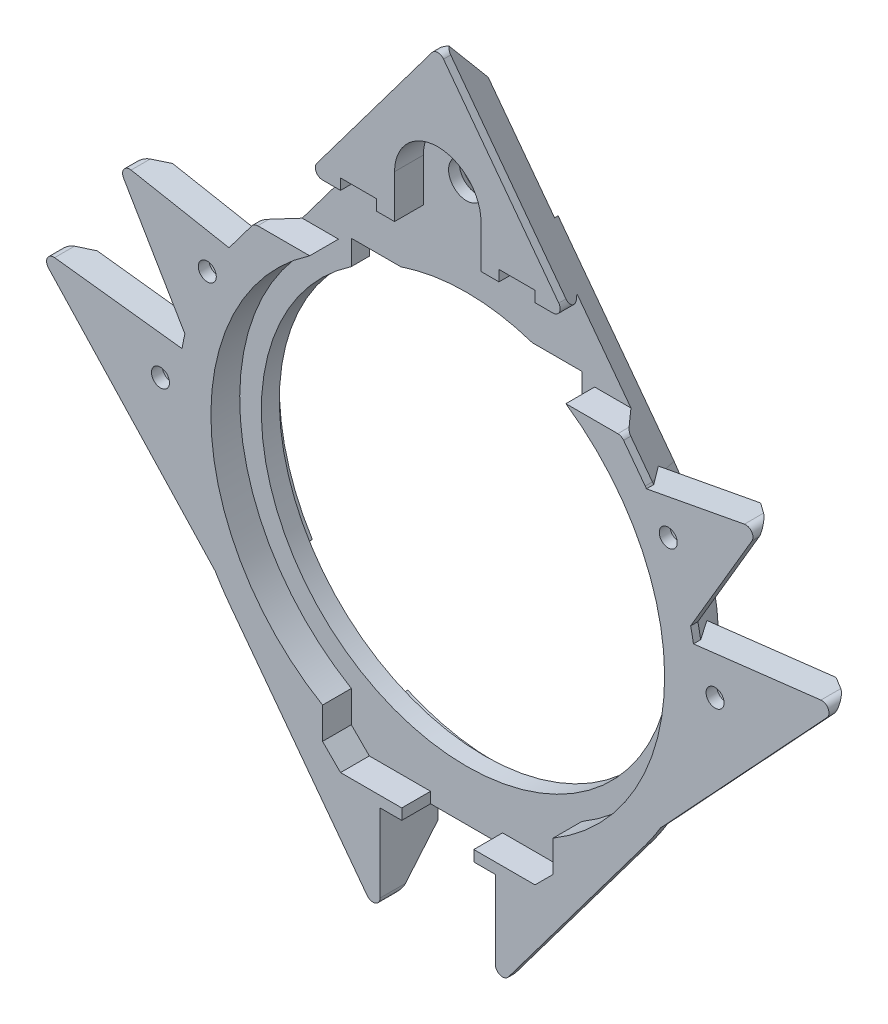
from build123d import *
from OCP.BRepFilletAPI import BRepFilletAPI_MakeChamfer

# Parameters (mm, degrees)
SKETCH_1_R                = 28.5
EXTRUDE_1_DEPTH           = 8
CHAMFER_12_SIZE           = 7
CHAMFER_12_SIZE2          = 5
SKETCH_11_R               = 30
CUT_EXTRUDE_1_DEPTH       = 1.5
EXTRUDE_5_DEPTH           = 4
EXTRUDE_5_2_DEPTH         = 4
EXTRUDE_5_3_DEPTH         = 4
EXTRUDE_5_4_DEPTH         = 4
CHAMFER_13_SIZE           = 3
CHAMFER_14_SIZE           = 3
CHAMFER_15_SIZE           = 3
CHAMFER_16_SIZE           = 3
CUT_EXTRUDE_7_DEPTH       = 4
SKETCH_13_W               = 16
SKETCH_13_H               = 26
CUT_EXTRUDE_2_DEPTH       = 4
CUT_EXTRUDE_8_DEPTH       = 4
CUT_EXTRUDE_9_DEPTH       = 83.10418193
CUT_EXTRUDE_9_DEPTH_BACK  = 2.5
SKETCH_25_R               = 3
HOLE_WIZARD_2_5_2_5_1_D   = 2.5
CUT_EXTRUDE_10_DEPTH      = 83.395974965
CUT_EXTRUDE_10_DEPTH_BACK = 83.395974965
SKETCH_28_R               = 2.5
SKETCH_30_W               = 3
SKETCH_30_H               = 1.5
EXTRUDE_6_DEPTH           = 4
SKETCH_31_W               = 16
SKETCH_31_H               = 20.928571429
CUT_EXTRUDE_11_DEPTH      = 83.104181935
SKETCH_29_W               = 5
SKETCH_29_H               = 1.5
CUT_EXTRUDE_12_DEPTH      = 4
SKETCH_32_R               = 6
SKETCH_32_R_2             = 2.5
CUT_EXTRUDE_13_DEPTH      = 4
CUT_EXTRUDE_14_DEPTH      = 1
CHAMFER_19_SIZE           = 1.5
SKETCH_34_R               = 35
SKETCH_34_R_2             = 17.5
CUT_EXTRUDE_15_DEPTH      = 1
SKETCH_35_W               = 32
SKETCH_35_H               = 9
CUT_EXTRUDE_16_DEPTH      = 2.5
FILLET_1_R                = 1


with BuildPart() as part:
    # Эскиз1 → Бобышка-Вытянуть1 (new body)
    with BuildSketch(Plane.XY):
        with BuildLine():
            Line((0, 60), (28.8, 21.6))
            ThreePointArc((28.8, 21.6), (36, 0), (28.8, -21.6))
            Line((28.8, -21.6), (0, -60))
            Line((0, -60), (-28.8, -21.6))
            ThreePointArc((-28.8, -21.6), (-36, 0), (-28.8, 21.6))
            Line((-28.8, 21.6), (0, 60))
        make_face()
        Circle(SKETCH_1_R, mode=Mode.SUBTRACT)
    extrude(amount=EXTRUDE_1_DEPTH)

    # Фаска12: one chamfer whose edges measure the first distance from different faces: ONE call of the kernel's chamfer builder (chamfer() names one face for all edges)
    chamfer_12_edges_1 = [part.edges().sort_by_distance(p)[0] for p in [
        (36, 0, 0),
    ]]
    chamfer_12_side_1 = [part.faces().sort_by_distance(p)[0] for p in [
        (36, 0, 4),
    ]]
    chamfer_12_edges_2 = [part.edges().sort_by_distance(p)[0] for p in [
        (14.4, -40.8, 0),
    ]]
    chamfer_12_side_2 = [part.faces().sort_by_distance(p)[0] for p in [
        (14.4, -40.8, 4),
    ]]
    chamfer_12_edges_3 = [part.edges().sort_by_distance(p)[0] for p in [
        (-14.4, -40.8, 0),
    ]]
    chamfer_12_side_3 = [part.faces().sort_by_distance(p)[0] for p in [
        (-14.4, -40.8, 4),
    ]]
    chamfer_12_edges_4 = [part.edges().sort_by_distance(p)[0] for p in [
        (-36, 0, 0),
    ]]
    chamfer_12_side_4 = [part.faces().sort_by_distance(p)[0] for p in [
        (-36, 0, 4),
    ]]
    chamfer_12_edges_5 = [part.edges().sort_by_distance(p)[0] for p in [
        (-14.4, 40.8, 0),
    ]]
    chamfer_12_side_5 = [part.faces().sort_by_distance(p)[0] for p in [
        (-14.4, 40.8, 4),
    ]]
    chamfer_12_edges_6 = [part.edges().sort_by_distance(p)[0] for p in [
        (14.4, 40.8, 0),
    ]]
    chamfer_12_side_6 = [part.faces().sort_by_distance(p)[0] for p in [
        (14.4, 40.8, 4),
    ]]
    chamfer_12 = BRepFilletAPI_MakeChamfer(part.part.solid().wrapped)
    for e in chamfer_12_edges_1:
        chamfer_12.Add(CHAMFER_12_SIZE, CHAMFER_12_SIZE2, e.wrapped, chamfer_12_side_1[0].wrapped)  # the first distance lies on this face
    for e in chamfer_12_edges_2:
        chamfer_12.Add(CHAMFER_12_SIZE, CHAMFER_12_SIZE2, e.wrapped, chamfer_12_side_2[0].wrapped)  # the first distance lies on this face
    for e in chamfer_12_edges_3:
        chamfer_12.Add(CHAMFER_12_SIZE, CHAMFER_12_SIZE2, e.wrapped, chamfer_12_side_3[0].wrapped)  # the first distance lies on this face
    for e in chamfer_12_edges_4:
        chamfer_12.Add(CHAMFER_12_SIZE, CHAMFER_12_SIZE2, e.wrapped, chamfer_12_side_4[0].wrapped)  # the first distance lies on this face
    for e in chamfer_12_edges_5:
        chamfer_12.Add(CHAMFER_12_SIZE, CHAMFER_12_SIZE2, e.wrapped, chamfer_12_side_5[0].wrapped)  # the first distance lies on this face
    for e in chamfer_12_edges_6:
        chamfer_12.Add(CHAMFER_12_SIZE, CHAMFER_12_SIZE2, e.wrapped, chamfer_12_side_6[0].wrapped)  # the first distance lies on this face
    add(Compound.cast(chamfer_12.Shape()), mode=Mode.REPLACE)

    # Эскиз11 → Вырез-Вытянуть1 (cut)
    with BuildSketch(Plane(origin=(0, 0, 0), x_dir=(-1, 0, 0), z_dir=(0, 0, -1))):
        Circle(SKETCH_11_R)
    extrude(amount=-CUT_EXTRUDE_1_DEPTH, mode=Mode.SUBTRACT)


with BuildPart() as body_2:
    # Эскиз17 → Бобышка-Вытянуть5 (new body)
    with BuildSketch(Plane(origin=(0, 0, 8), x_dir=(-1, 0, 0), z_dir=(0, 0, -1))):
        with BuildLine():
            Line((25.238858928, -18), (28.902564257, -20.612903226))
            Line((28.902564257, -20.612903226), (55.902564257, 8.387096774))
            Line((55.902564257, 8.387096774), (30.528334189, 5.387096774))
            ThreePointArc((30.528334189, 5.387096774), (30.236303195, -6.838564841), (25.238858928, -18))
        make_face()
    extrude(amount=EXTRUDE_5_DEPTH)

    # Фаска13
    chamfer_13_edges = [body_2.edges().sort_by_distance(p)[0] for p in [
        (-42.402564257, -6.112903226, 4),
    ]]
    chamfer(chamfer_13_edges, length=CHAMFER_13_SIZE)


with BuildPart() as body_3:
    # Эскиз17 → Extrude 5 2 (new body)
    with BuildSketch(Plane(origin=(0, 0, 8), x_dir=(-1, 0, 0), z_dir=(0, 0, -1))):
        with BuildLine():
            Line((-28.902564257, -20.612903226), (-25.238858928, -18))
            ThreePointArc((-25.238858928, -18), (-30.236303195, -6.838564841), (-30.528334189, 5.387096774))
            Line((-30.528334189, 5.387096774), (-55.902564257, 8.387096774))
            Line((-55.902564257, 8.387096774), (-28.902564257, -20.612903226))
        make_face()
    extrude(amount=EXTRUDE_5_2_DEPTH)

    # Фаска14
    chamfer_14_edges = [body_3.edges().sort_by_distance(p)[0] for p in [
        (42.402564257, -6.112903226, 4),
    ]]
    chamfer(chamfer_14_edges, length=CHAMFER_14_SIZE)


with BuildPart() as body_4:
    # Эскиз17 → Extrude 5 3 (new body)
    with BuildSketch(Plane(origin=(0, 0, 8), x_dir=(-1, 0, 0), z_dir=(0, 0, -1))):
        with BuildLine():
            ThreePointArc((23.416468646, 20.314255983), (27.763165047, 13.791543298), (30.334880827, 6.387096774))
            Line((30.334880827, 6.387096774), (34.73833127, 7.314255983))
            Line((34.73833127, 7.314255983), (44.73833127, 24.314255983))
            Line((44.73833127, 24.314255983), (23.416468646, 20.314255983))
        make_face()
    extrude(amount=EXTRUDE_5_3_DEPTH)

    # Фаска16
    chamfer_16_edges = [body_4.edges().sort_by_distance(p)[0] for p in [
        (-39.73833127, 15.814255983, 4),
    ]]
    chamfer(chamfer_16_edges, length=CHAMFER_16_SIZE)


with BuildPart() as body_5:
    # Эскиз17 → Extrude 5 4 (new body)
    with BuildSketch(Plane(origin=(0, 0, 8), x_dir=(-1, 0, 0), z_dir=(0, 0, -1))):
        with BuildLine():
            Line((-34.73833127, 7.314255983), (-30.334880827, 6.387096774))
            ThreePointArc((-30.334880827, 6.387096774), (-27.763165047, 13.791543298), (-23.416468646, 20.314255983))
            Line((-23.416468646, 20.314255983), (-44.73833127, 24.314255983))
            Line((-44.73833127, 24.314255983), (-34.73833127, 7.314255983))
        make_face()
    extrude(amount=EXTRUDE_5_4_DEPTH)

    # Фаска15
    chamfer_15_edges = [body_5.edges().sort_by_distance(p)[0] for p in [
        (39.73833127, 15.814255983, 4),
    ]]
    chamfer(chamfer_15_edges, length=CHAMFER_15_SIZE)


with BuildPart() as body_2_1:
    add(body_2.part)

    # Combine 2: union body 3, body 5, body 4, part
    add(body_3.part)
    add(body_5.part)
    add(body_4.part)
    add(part.part)

    # Эскиз23 → Вырез-Вытянуть7 (cut)
    with BuildSketch(Plane.XY.offset(8)):
        with BuildLine():
            Line((13.5, -34), (16, -31.5))
            Line((16, -31.5), (16, -23.58495283))
            ThreePointArc((16, -23.58495283), (0, -28.5), (-16, -23.58495283))
            Line((-16, -23.58495283), (-16, -31.5))
            Line((-16, -31.5), (-13.5, -34))
            Line((-13.5, -34), (13.5, -34))
        make_face()
        with BuildLine():
            Line((16, 23.58495283), (16, 26))
            Line((16, 26), (25.5, 26))
            Line((25.5, 26), (18, 36))
            Line((18, 36), (-18, 36))
            Line((-18, 36), (-25.5, 26))
            Line((-25.5, 26), (-16, 26))
            Line((-16, 26), (-16, 23.58495283))
            ThreePointArc((-16, 23.58495283), (0, 28.5), (16, 23.58495283))
        make_face()
    extrude(amount=-CUT_EXTRUDE_7_DEPTH, mode=Mode.SUBTRACT)

    # Эскиз13 → Вырез-Вытянуть2 (cut)
    with BuildSketch(Plane.XY.offset(8)):
        with Locations((0, -47)):
            Rectangle(SKETCH_13_W, SKETCH_13_H)
    extrude(amount=-CUT_EXTRUDE_2_DEPTH, mode=Mode.SUBTRACT)

    # Эскиз24 → Вырез-Вытянуть8 (cut)
    with BuildSketch(Plane.XY.offset(8)):
        with BuildLine():
            Line((-16, 26), (-17.783419244, 26))
            ThreePointArc((-17.783419244, 26), (-31.482271301, -1.056689982), (-16, -27.133927102))
            Line((-16, -27.133927102), (-16, -23.58495283))
            ThreePointArc((-16, -23.58495283), (-28.5, 0), (-16, 23.58495283))
            Line((-16, 23.58495283), (-16, 26))
        make_face()
        with BuildLine():
            ThreePointArc((31.5, 0), (27.860614729, 14.698168148), (17.783419244, 26))
            Line((17.783419244, 26), (16, 26))
            Line((16, 26), (16, 23.58495283))
            ThreePointArc((16, 23.58495283), (25.181838694, 13.346347815), (28.5, 0))
            ThreePointArc((28.5, 0), (25.181838694, -13.346347815), (16, -23.58495283))
            Line((16, -23.58495283), (16, -27.133927102))
            ThreePointArc((16, -27.133927102), (27.351873793, -15.624499992), (31.5, 0))
        make_face()
    extrude(amount=-CUT_EXTRUDE_8_DEPTH, mode=Mode.SUBTRACT)

    # Эскиз25 → Вырез-Вытянуть9 (cut, two sides: drawn at the far end of the back side and taken through both)
    with BuildSketch(Plane(origin=(0, 0, 4), x_dir=(-1, 0, 0), z_dir=(0, 0, -1)).offset(-CUT_EXTRUDE_9_DEPTH_BACK)):
        with Locations(Location((-32, 17, 0), (0, 0, 295.932664692))):
            Circle(SKETCH_25_R)
        with Locations(Location((-38.5, 1, 0), (0, 0, 180))):
            Circle(SKETCH_25_R)
        with Locations(Location((32, 17, 0), (0, 0, 171.891613469))):
            Circle(SKETCH_25_R)
        with Locations(Location((38.5, 1, 0), (0, 0, 180))):
            Circle(SKETCH_25_R)
    extrude(amount=CUT_EXTRUDE_9_DEPTH + CUT_EXTRUDE_9_DEPTH_BACK, mode=Mode.SUBTRACT)

    # Диаметр отверстия Ø2.5 (2.5)1 (through all)
    with Locations(Plane(origin=(0, 0, 6.5), x_dir=(-1, 0, 0), z_dir=(0, 0, -1))):
        with Locations((-32, 17), (-38.5, 1), (32, 17), (38.5, 1)):
            Hole(HOLE_WIZARD_2_5_2_5_1_D / 2)

    # Эскиз28 → Вырез-Вытянуть10 (cut, two sides: drawn at the far end of the back side and taken through both)
    with BuildSketch(Plane(origin=(0, 0, 0), x_dir=(-1, 0, 0), z_dir=(0, 0, -1)).offset(-CUT_EXTRUDE_10_DEPTH_BACK)):
        with Locations((0, 42)):
            Circle(SKETCH_28_R)
    extrude(amount=CUT_EXTRUDE_10_DEPTH + CUT_EXTRUDE_10_DEPTH_BACK, mode=Mode.SUBTRACT)

    # Эскиз30 → Бобышка-Вытянуть6 (add)
    with BuildSketch(Plane.XY.offset(4)):
        with Locations((-6.5, -34.75)):
            Rectangle(SKETCH_30_W, SKETCH_30_H)
        with Locations((6.5, -34.75)):
            Rectangle(SKETCH_30_W, SKETCH_30_H)
    extrude(amount=EXTRUDE_6_DEPTH)

    # Эскиз31 → Вырез-Вытянуть11 (cut, through all)
    with BuildSketch(Plane.XY.offset(4)):
        with Locations((0, -45.964285715)):
            Rectangle(SKETCH_31_W, SKETCH_31_H)
    extrude(amount=-CUT_EXTRUDE_11_DEPTH, mode=Mode.SUBTRACT)

    # Эскиз29 → Вырез-Вытянуть12 (cut)
    with BuildSketch(Plane.XY.offset(8)):
        with Locations((-11, 36.75)):
            Rectangle(SKETCH_29_W, SKETCH_29_H)
        with Locations((11, 36.75)):
            Rectangle(SKETCH_29_W, SKETCH_29_H)
    extrude(amount=-CUT_EXTRUDE_12_DEPTH, mode=Mode.SUBTRACT)

    # Эскиз32 → Вырез-Вытянуть13 (cut)
    # profile 1 of 3: a face of its own
    with BuildSketch(Plane.XY.offset(8)):
        with Locations((0, 42)):
            Circle(SKETCH_32_R)
        with Locations((0, 42)):
            Circle(SKETCH_32_R_2, mode=Mode.SUBTRACT)
    # profile 2 of 3: a face of its own
    with BuildSketch(Plane.XY.offset(8)):
        with BuildLine():
            ThreePointArc((0, 36), (-4.242640687, 37.757359313), (-6, 42))
            Line((-6, 42), (-6, 36))
            Line((-6, 36), (0, 36))
        make_face()
    # profile 3 of 3: a face of its own
    with BuildSketch(Plane.XY.offset(8)):
        with BuildLine():
            Line((6, 36), (6, 42))
            ThreePointArc((6, 42), (4.242640687, 37.757359313), (0, 36))
            Line((0, 36), (6, 36))
        make_face()
    extrude(amount=-CUT_EXTRUDE_13_DEPTH, mode=Mode.SUBTRACT)

    # Эскиз33 → Вырез-Вытянуть14 (cut)
    with BuildSketch(Plane(origin=(0, 0, 0), x_dir=(-1, 0, 0), z_dir=(0, 0, -1))):
        with BuildLine():
            Line((-12.532635049, 43.289819934), (0, 60))
            Line((0, 60), (12.532635049, 43.289819934))
            ThreePointArc((12.532635049, 43.289819934), (6.179836993, 37.318603148), (1.5, 29.962476533))
            ThreePointArc((1.5, 29.962476533), (0, 30), (-1.5, 29.962476533))
            ThreePointArc((-1.5, 29.962476533), (-6.179836993, 37.318603148), (-12.532635049, 43.289819934))
        make_face()
    extrude(amount=-CUT_EXTRUDE_14_DEPTH, mode=Mode.SUBTRACT)

    # Фаска19
    chamfer_19_edges = [body_2_1.edges().sort_by_distance(p)[0] for p in [
        (2.5, 42, 1),
    ]]
    chamfer(chamfer_19_edges, length=CHAMFER_19_SIZE)

    # Эскиз34 → Вырез-Вытянуть15 (cut)
    with BuildSketch(Plane(origin=(0, 0, 0), x_dir=(-1, 0, 0), z_dir=(0, 0, -1))):
        with Locations((0, -40)):
            Circle(SKETCH_34_R)
        with Locations((0, -40)):
            Circle(SKETCH_34_R_2, mode=Mode.SUBTRACT)
    extrude(amount=-CUT_EXTRUDE_15_DEPTH, mode=Mode.SUBTRACT)

    # Эскиз35 → Вырез-Вытянуть16 (cut)
    with BuildSketch(Plane.XY.offset(4)):
        with Locations((0, 22.5)):
            Rectangle(SKETCH_35_W, SKETCH_35_H)
    extrude(amount=-CUT_EXTRUDE_16_DEPTH, mode=Mode.SUBTRACT)

    # Скругление1
    fillet_1_edges = [body_2_1.edges().sort_by_distance(p)[0] for p in [
        (25.5, 26, 7.5),
        (-18, 36, 7.5),
        (18, 36, 7.5),
        (-8, -49.333333333, 7.5),
        (8, -49.333333333, 7.5),
        (-55.902564257, 8.387096774, 7.5),
        (55.902564257, 8.387096774, 7.5),
        (44.73833127, 24.314255983, 7.5),
        (-44.73833127, 24.314255983, 7.5),
        (0, 60, 7.5),
        (-25.5, 26, 7.5),
    ]]
    fillet(fillet_1_edges, radius=FILLET_1_R)


solid = body_2_1.part
